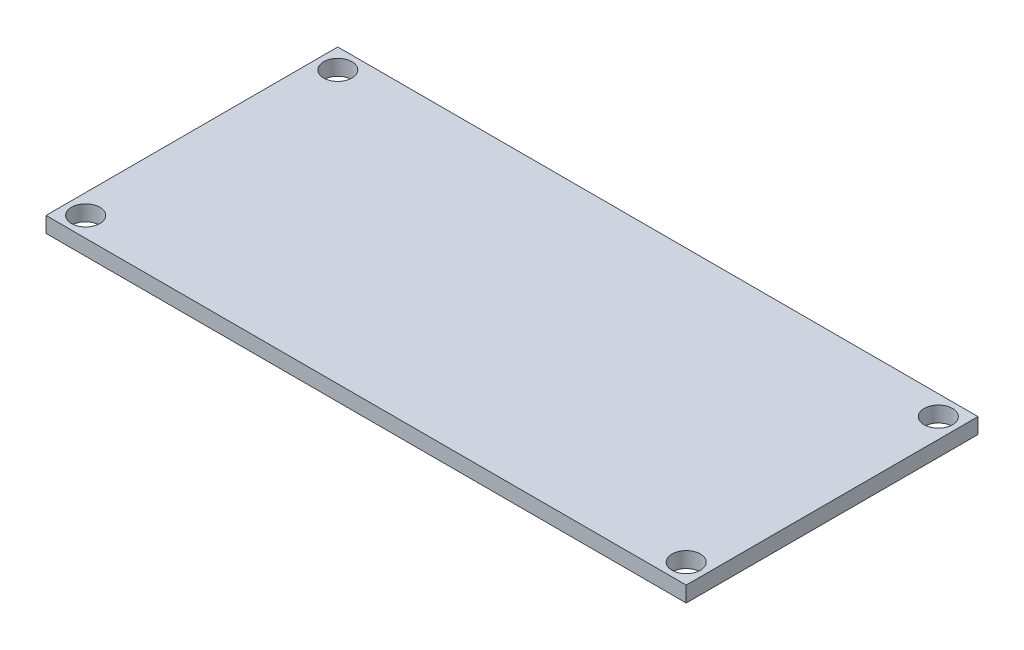
from build123d import *

# Parameters (mm, degrees)
SKETCH1_W           = 45.2
SKETCH1_H           = 20.6
BOSS_EXTRUDE1_DEPTH = 1.1
SKETCH18_R          = 1
CUT_EXTRUDE4_DEPTH  = 25.860812537


with BuildPart() as part:
    # Sketch1 → Boss-Extrude1 (new body)
    with BuildSketch(Plane(origin=(0, 0, 0), x_dir=(1, 0, 0), z_dir=(0, 1, 0))):
        Rectangle(SKETCH1_W, SKETCH1_H)
    extrude(amount=BOSS_EXTRUDE1_DEPTH)

    # Sketch18 → Cut-Extrude4 (cut, through all)
    with BuildSketch(Plane(origin=(0, 1.1, 0), x_dir=(1, 0, 0), z_dir=(0, 1, 0))):
        with Locations(Location((-21.2, -8.9, 0), (0, 0, 270))):
            Circle(SKETCH18_R)
        with Locations(Location((21.2, 8.9, 0), (0, 0, 270))):
            Circle(SKETCH18_R)
    cut_extrude4 = extrude(amount=-CUT_EXTRUDE4_DEPTH, mode=Mode.SUBTRACT)

    # Mirror1: Cut-Extrude4 across plane
    add(cut_extrude4.mirror(Plane(origin=(0, 0, 0), x_dir=(0, 0, 1), z_dir=(1, 0, 0))), mode=Mode.SUBTRACT)


solid = part.part
